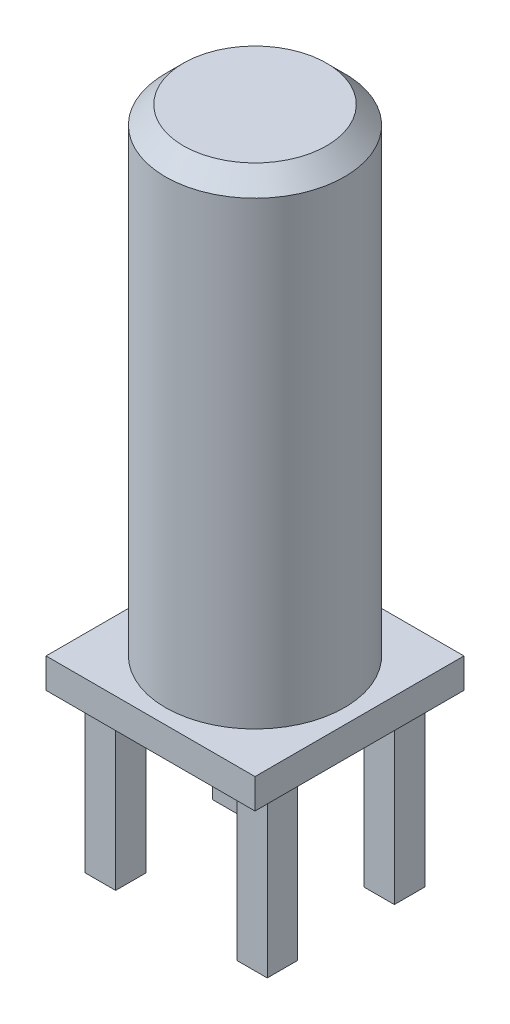
from build123d import *

# Parameters (mm, degrees)
SKETCH1_W           = 7
SKETCH1_H           = 7
BOSS_EXTRUDE1_DEPTH = 1
SKETCH2_W           = 1.02
SKETCH2_H           = 1.02
BOSS_EXTRUDE2_DEPTH = 5.5
SKETCH4_R           = 3
BOSS_EXTRUDE3_DEPTH = 16
CHAMFER1_SIZE       = 0.6


with BuildPart() as part:
    # Sketch1 → Boss-Extrude1 (new body)
    with BuildSketch(Plane(origin=(0, 0, 0), x_dir=(1, 0, 0), z_dir=(0, 1, 0))):
        Rectangle(SKETCH1_W, SKETCH1_H)
    extrude(amount=BOSS_EXTRUDE1_DEPTH)

    # Sketch2 → Boss-Extrude2 (add)
    with BuildSketch(Plane.XZ):
        with Locations((-2.54, 2.129508614)):
            Rectangle(SKETCH2_W, SKETCH2_H)
        with Locations((-2.54, -2.129508614)):
            Rectangle(SKETCH2_W, SKETCH2_H)
        with Locations((2.54, 2.129508614)):
            Rectangle(SKETCH2_W, SKETCH2_H)
        with Locations((2.54, -2.129508614)):
            Rectangle(SKETCH2_W, SKETCH2_H)
    extrude(amount=BOSS_EXTRUDE2_DEPTH)

    # Sketch4 → Boss-Extrude3 (add)
    with BuildSketch(Plane(origin=(0, 1, 0), x_dir=(1, 0, 0), z_dir=(0, 1, 0))):
        with Locations(Location((0, 0, 0), (0, 0, 270))):
            Circle(SKETCH4_R)
    extrude(amount=BOSS_EXTRUDE3_DEPTH)

    # Chamfer1
    chamfer1_edges = [part.edges().sort_by_distance(p)[0] for p in [
        (0, 17, -3),
    ]]
    chamfer(chamfer1_edges, length=CHAMFER1_SIZE)


solid = part.part
